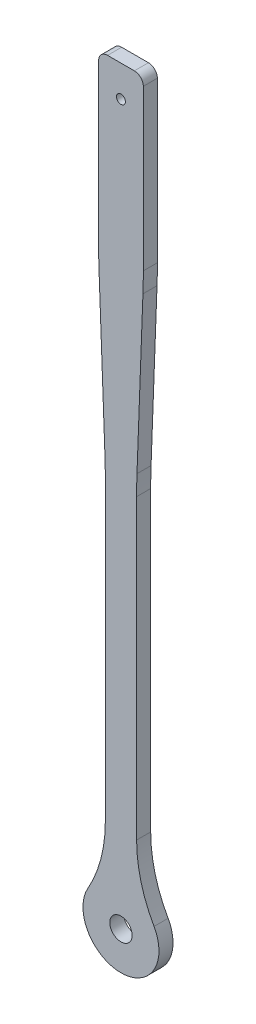
from build123d import *

# Parameters (mm, degrees)
SKETCH2_R           = 1.27
SKETCH2_R_2         = 3.175
BOSS_EXTRUDE1_DEPTH = 4


with BuildPart() as part:
    # Sketch2 → Boss-Extrude1 (new body)
    with BuildSketch(Plane.XY):
        with BuildLine():
            Line((4.552043366, 53.654489758), (6.242956634, 98.745510242))
            ThreePointArc((6.242956634, 98.745510242), (6.323236809, 101.600501634), (6.35, 104.456496116))
            Line((6.35, 104.456496116), (6.35, 149.86))
            ThreePointArc((6.35, 149.86), (5.606051224, 151.656051224), (3.81, 152.4))
            Line((3.81, 152.4), (-3.81, 152.4))
            ThreePointArc((-3.81, 152.4), (-5.606051224, 151.656051224), (-6.35, 149.86))
            Line((-6.35, 149.86), (-6.35, 104.456496116))
            ThreePointArc((-6.35, 104.456496116), (-6.323236809, 101.600501634), (-6.242956634, 98.745510242))
            Line((-6.242956634, 98.745510242), (-4.552043366, 53.654489758))
            ThreePointArc((-4.552043366, 53.654489758), (-4.471763191, 50.799498366), (-4.445, 47.943503884))
            Line((-4.445, 47.943503884), (-4.445, -36.540821929))
            ThreePointArc((-4.445, -36.540821929), (-5.702774085, -46.249600926), (-9.393051948, -55.317358893))
            ThreePointArc((-9.393051948, -55.317358893), (0, -71.432377699), (9.393051948, -55.317358893))
            ThreePointArc((9.393051948, -55.317358893), (5.702774085, -46.249600926), (4.445, -36.540821929))
            Line((4.445, -36.540821929), (4.445, 47.943503884))
            ThreePointArc((4.445, 47.943503884), (4.471763191, 50.799498366), (4.552043366, 53.654489758))
        make_face()
        with Locations((0, 143.51)):
            Circle(SKETCH2_R, mode=Mode.SUBTRACT)
        with Locations((0, -60.637377699)):
            Circle(SKETCH2_R_2, mode=Mode.SUBTRACT)
    extrude(amount=BOSS_EXTRUDE1_DEPTH)


solid = part.part
